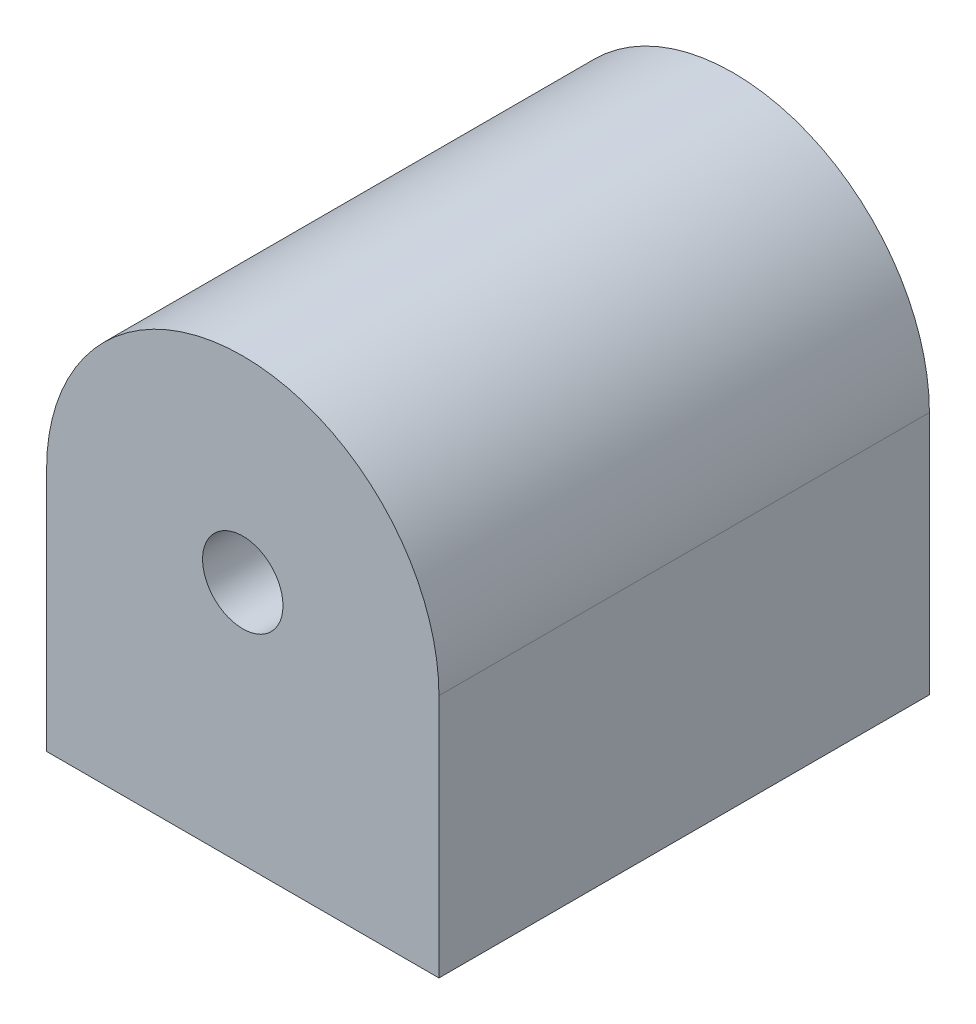
from build123d import *

# Parameters (mm, degrees)
CROQUIS1_R              = 8.195471625
SALIENTE_EXTRUIR1_DEPTH = 50


with BuildPart() as part:
    # Croquis1 → Saliente-Extruir1 (new, symmetric)
    with BuildSketch(Plane.XY):
        with BuildLine():
            Line((-40, 0), (-40, -49.847177631))
            Line((-40, -49.847177631), (40, -49.847177631))
            Line((40, -49.847177631), (40, 0))
            ThreePointArc((40, 0), (0, 40), (-40, 0))
        make_face()
        Circle(CROQUIS1_R, mode=Mode.SUBTRACT)
    extrude(amount=SALIENTE_EXTRUIR1_DEPTH, both=True)


solid = part.part
